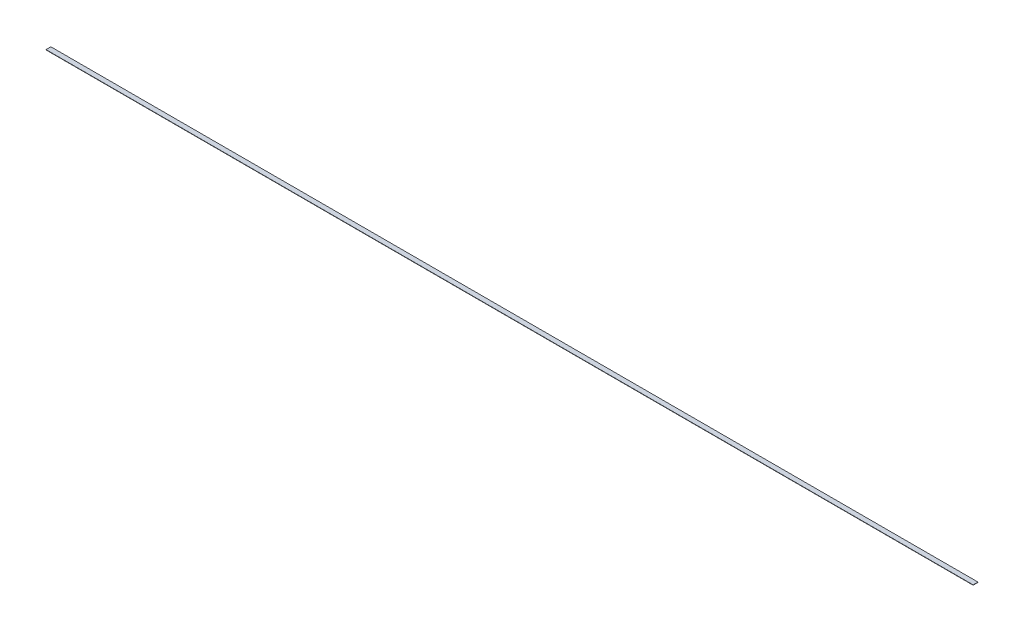
from build123d import *

# Parameters (mm, degrees)
SKETCH1_W           = 9702.8
SKETCH1_H           = 50.8
BOSS_EXTRUDE1_DEPTH = 3.175


with BuildPart() as part:
    # Sketch1 → Boss-Extrude1 (new body)
    with BuildSketch(Plane(origin=(0, 0, 0), x_dir=(1, 0, 0), z_dir=(0, 1, 0))):
        with Locations((4851.4, 25.4)):
            Rectangle(SKETCH1_W, SKETCH1_H)
    extrude(amount=BOSS_EXTRUDE1_DEPTH)


solid = part.part
